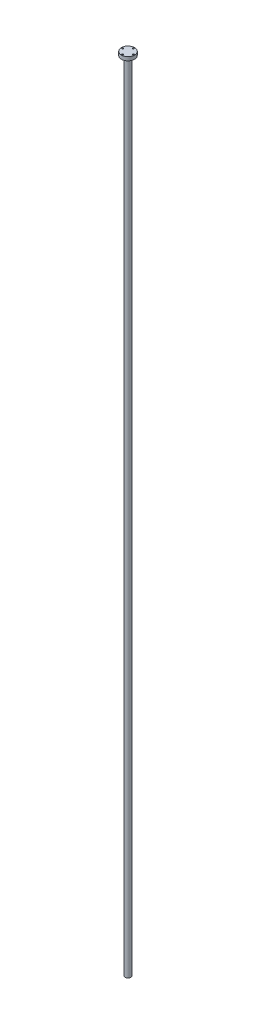
from build123d import *

# Parameters (mm, degrees)
SKETCH1_R                = 9
BRACKETMOUNT_DEPTH       = 5
SKETCH2_R                = 1
BRACKET_MOUNTHOLES_DEPTH = 5
SKETCH3_R                = 4
STEPPERSLEEVE_DEPTH      = 1094
ORIENTATIONNUB_DEPTH     = 1094


with BuildPart() as part:
    # Sketch1 → BracketMount (new body)
    with BuildSketch(Plane(origin=(0, 0, 0), x_dir=(1, 0, 0), z_dir=(0, 1, 0))):
        with Locations(Location((0, 0, 0), (0, 0, 270))):
            Circle(SKETCH1_R)
    extrude(amount=BRACKETMOUNT_DEPTH)

    # Sketch2 → Bracket-MountHoles (cut)
    with BuildSketch(Plane(origin=(0, 5, 0), x_dir=(1, 0, 0), z_dir=(0, 1, 0))):
        with Locations(Location((0, 7.25, 0), (0, 0, 270))):
            Circle(SKETCH2_R)
        with Locations(Location((7.25, 0, 0), (0, 0, 270))):
            Circle(SKETCH2_R)
        with Locations(Location((0, -7.25, 0), (0, 0, 270))):
            Circle(SKETCH2_R)
        with Locations(Location((-7.25, 0, 0), (0, 0, 270))):
            Circle(SKETCH2_R)
    extrude(amount=-BRACKET_MOUNTHOLES_DEPTH, mode=Mode.SUBTRACT)

    # Sketch3 → StepperSleeve (add)
    with BuildSketch(Plane.XZ):
        with Locations(Location((0, 0, 0), (0, 0, 90))):
            Circle(SKETCH3_R)
    extrude(amount=STEPPERSLEEVE_DEPTH)

    # Sketch5 → OrientationNub (cut)
    with BuildSketch(Plane.XZ.offset(1094)):
        with BuildLine():
            Line((1.92, 1.75316856), (1.92, -1.75316856))
            ThreePointArc((1.92, -1.75316856), (-2.6, 0), (1.92, 1.75316856))
        make_face()
    extrude(amount=-ORIENTATIONNUB_DEPTH, mode=Mode.SUBTRACT)


solid = part.part
